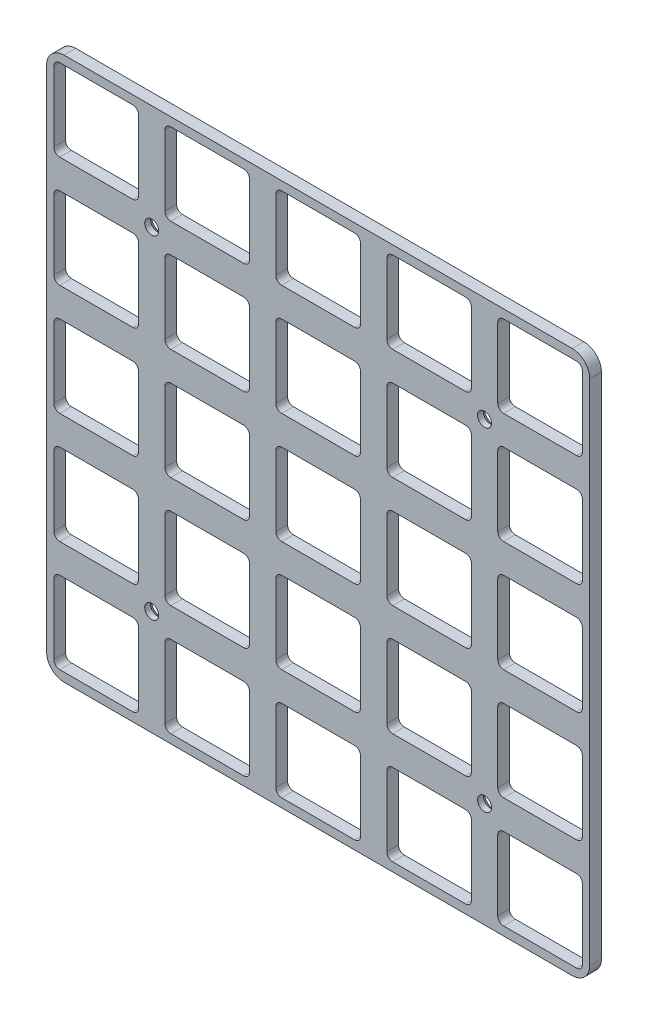
from build123d import *

# Parameters (mm, degrees)
BOSS_EXTRUDE1_DEPTH                            = 2
CSK_FOR_M2_FLAT_HEAD_MACHINE_SCREW1_AT_2_COUNT = 2
CSK_FOR_M2_FLAT_HEAD_MACHINE_SCREW1_AT_2_PITCH = 57
CSK_FOR_M2_FLAT_HEAD_MACHINE_SCREW1_AT_3_COUNT = 2
CSK_FOR_M2_FLAT_HEAD_MACHINE_SCREW1_AT_3_PITCH = 80.610173055
CSK_FOR_M2_FLAT_HEAD_MACHINE_SCREW1_AT_4_COUNT = 2
CSK_FOR_M2_FLAT_HEAD_MACHINE_SCREW1_AT_4_PITCH = 57


with BuildPart() as part:
    # Sketch2 → Boss-Extrude1 (new body)
    with BuildSketch(Plane.XY):
        with BuildLine():
            Line((-43.5, 46.5), (43.5, 46.5))
            ThreePointArc((43.5, 46.5), (45.621320344, 45.621320344), (46.5, 43.5))
            Line((46.5, 43.5), (46.5, -43.5))
            ThreePointArc((46.5, -43.5), (45.621320344, -45.621320344), (43.5, -46.5))
            Line((43.5, -46.5), (-43.5, -46.5))
            ThreePointArc((-43.5, -46.5), (-45.621320344, -45.621320344), (-46.5, -43.5))
            Line((-46.5, -43.5), (-46.5, 43.5))
            ThreePointArc((-46.5, 43.5), (-45.621320344, 45.621320344), (-43.5, 46.5))
        make_face()
        with BuildLine():
            Line((-26.25, 44), (-26.25, 32))
            ThreePointArc((-26.25, 32), (-25.957106781, 31.292893219), (-25.25, 31))
            Line((-25.25, 31), (-12.75, 31))
            ThreePointArc((-12.75, 31), (-12.042893219, 31.292893219), (-11.75, 32))
            Line((-11.75, 32), (-11.75, 44))
            ThreePointArc((-11.75, 44), (-12.042893219, 44.707106781), (-12.75, 45))
            Line((-12.75, 45), (-25.25, 45))
            ThreePointArc((-25.25, 45), (-25.957106781, 44.707106781), (-26.25, 44))
        make_face(mode=Mode.SUBTRACT)
        with BuildLine():
            Line((-44.25, 45), (-31.75, 45))
            ThreePointArc((-31.75, 45), (-31.042893219, 44.707106781), (-30.75, 44))
            Line((-30.75, 44), (-30.75, 32))
            ThreePointArc((-30.75, 32), (-31.042893219, 31.292893219), (-31.75, 31))
            Line((-31.75, 31), (-44.25, 31))
            ThreePointArc((-44.25, 31), (-44.957106781, 31.292893219), (-45.25, 32))
            Line((-45.25, 32), (-45.25, 44))
            ThreePointArc((-45.25, 44), (-44.957106781, 44.707106781), (-44.25, 45))
        make_face(mode=Mode.SUBTRACT)
        with BuildLine():
            Line((-7.25, 44), (-7.25, 32))
            ThreePointArc((-7.25, 32), (-6.957106781, 31.292893219), (-6.25, 31))
            Line((-6.25, 31), (6.25, 31))
            ThreePointArc((6.25, 31), (6.957106781, 31.292893219), (7.25, 32))
            Line((7.25, 32), (7.25, 44))
            ThreePointArc((7.25, 44), (6.957106781, 44.707106781), (6.25, 45))
            Line((6.25, 45), (-6.25, 45))
            ThreePointArc((-6.25, 45), (-6.957106781, 44.707106781), (-7.25, 44))
        make_face(mode=Mode.SUBTRACT)
        with BuildLine():
            Line((11.75, 44), (11.75, 32))
            ThreePointArc((11.75, 32), (12.042893219, 31.292893219), (12.75, 31))
            Line((12.75, 31), (25.25, 31))
            ThreePointArc((25.25, 31), (25.957106781, 31.292893219), (26.25, 32))
            Line((26.25, 32), (26.25, 44))
            ThreePointArc((26.25, 44), (25.957106781, 44.707106781), (25.25, 45))
            Line((25.25, 45), (12.75, 45))
            ThreePointArc((12.75, 45), (12.042893219, 44.707106781), (11.75, 44))
        make_face(mode=Mode.SUBTRACT)
        with BuildLine():
            Line((30.75, 44), (30.75, 32))
            ThreePointArc((30.75, 32), (31.042893219, 31.292893219), (31.75, 31))
            Line((31.75, 31), (44.25, 31))
            ThreePointArc((44.25, 31), (44.957106781, 31.292893219), (45.25, 32))
            Line((45.25, 32), (45.25, 44))
            ThreePointArc((45.25, 44), (44.957106781, 44.707106781), (44.25, 45))
            Line((44.25, 45), (31.75, 45))
            ThreePointArc((31.75, 45), (31.042893219, 44.707106781), (30.75, 44))
        make_face(mode=Mode.SUBTRACT)
        with BuildLine():
            Line((-26.25, 25), (-26.25, 13))
            ThreePointArc((-26.25, 13), (-25.957106781, 12.292893219), (-25.25, 12))
            Line((-25.25, 12), (-12.75, 12))
            ThreePointArc((-12.75, 12), (-12.042893219, 12.292893219), (-11.75, 13))
            Line((-11.75, 13), (-11.75, 25))
            ThreePointArc((-11.75, 25), (-12.042893219, 25.707106781), (-12.75, 26))
            Line((-12.75, 26), (-25.25, 26))
            ThreePointArc((-25.25, 26), (-25.957106781, 25.707106781), (-26.25, 25))
        make_face(mode=Mode.SUBTRACT)
        with BuildLine():
            Line((-7.25, 25), (-7.25, 13))
            ThreePointArc((-7.25, 13), (-6.957106781, 12.292893219), (-6.25, 12))
            Line((-6.25, 12), (6.25, 12))
            ThreePointArc((6.25, 12), (6.957106781, 12.292893219), (7.25, 13))
            Line((7.25, 13), (7.25, 25))
            ThreePointArc((7.25, 25), (6.957106781, 25.707106781), (6.25, 26))
            Line((6.25, 26), (-6.25, 26))
            ThreePointArc((-6.25, 26), (-6.957106781, 25.707106781), (-7.25, 25))
        make_face(mode=Mode.SUBTRACT)
        with BuildLine():
            Line((11.75, 25), (11.75, 13))
            ThreePointArc((11.75, 13), (12.042893219, 12.292893219), (12.75, 12))
            Line((12.75, 12), (25.25, 12))
            ThreePointArc((25.25, 12), (25.957106781, 12.292893219), (26.25, 13))
            Line((26.25, 13), (26.25, 25))
            ThreePointArc((26.25, 25), (25.957106781, 25.707106781), (25.25, 26))
            Line((25.25, 26), (12.75, 26))
            ThreePointArc((12.75, 26), (12.042893219, 25.707106781), (11.75, 25))
        make_face(mode=Mode.SUBTRACT)
        with BuildLine():
            Line((30.75, 25), (30.75, 13))
            ThreePointArc((30.75, 13), (31.042893219, 12.292893219), (31.75, 12))
            Line((31.75, 12), (44.25, 12))
            ThreePointArc((44.25, 12), (44.957106781, 12.292893219), (45.25, 13))
            Line((45.25, 13), (45.25, 25))
            ThreePointArc((45.25, 25), (44.957106781, 25.707106781), (44.25, 26))
            Line((44.25, 26), (31.75, 26))
            ThreePointArc((31.75, 26), (31.042893219, 25.707106781), (30.75, 25))
        make_face(mode=Mode.SUBTRACT)
        with BuildLine():
            Line((-26.25, 6), (-26.25, -6))
            ThreePointArc((-26.25, -6), (-25.957106781, -6.707106781), (-25.25, -7))
            Line((-25.25, -7), (-12.75, -7))
            ThreePointArc((-12.75, -7), (-12.042893219, -6.707106781), (-11.75, -6))
            Line((-11.75, -6), (-11.75, 6))
            ThreePointArc((-11.75, 6), (-12.042893219, 6.707106781), (-12.75, 7))
            Line((-12.75, 7), (-25.25, 7))
            ThreePointArc((-25.25, 7), (-25.957106781, 6.707106781), (-26.25, 6))
        make_face(mode=Mode.SUBTRACT)
        with BuildLine():
            Line((-7.25, 6), (-7.25, -6))
            ThreePointArc((-7.25, -6), (-6.957106781, -6.707106781), (-6.25, -7))
            Line((-6.25, -7), (6.25, -7))
            ThreePointArc((6.25, -7), (6.957106781, -6.707106781), (7.25, -6))
            Line((7.25, -6), (7.25, 6))
            ThreePointArc((7.25, 6), (6.957106781, 6.707106781), (6.25, 7))
            Line((6.25, 7), (-6.25, 7))
            ThreePointArc((-6.25, 7), (-6.957106781, 6.707106781), (-7.25, 6))
        make_face(mode=Mode.SUBTRACT)
        with BuildLine():
            Line((11.75, 6), (11.75, -6))
            ThreePointArc((11.75, -6), (12.042893219, -6.707106781), (12.75, -7))
            Line((12.75, -7), (25.25, -7))
            ThreePointArc((25.25, -7), (25.957106781, -6.707106781), (26.25, -6))
            Line((26.25, -6), (26.25, 6))
            ThreePointArc((26.25, 6), (25.957106781, 6.707106781), (25.25, 7))
            Line((25.25, 7), (12.75, 7))
            ThreePointArc((12.75, 7), (12.042893219, 6.707106781), (11.75, 6))
        make_face(mode=Mode.SUBTRACT)
        with BuildLine():
            Line((30.75, 6), (30.75, -6))
            ThreePointArc((30.75, -6), (31.042893219, -6.707106781), (31.75, -7))
            Line((31.75, -7), (44.25, -7))
            ThreePointArc((44.25, -7), (44.957106781, -6.707106781), (45.25, -6))
            Line((45.25, -6), (45.25, 6))
            ThreePointArc((45.25, 6), (44.957106781, 6.707106781), (44.25, 7))
            Line((44.25, 7), (31.75, 7))
            ThreePointArc((31.75, 7), (31.042893219, 6.707106781), (30.75, 6))
        make_face(mode=Mode.SUBTRACT)
        with BuildLine():
            Line((-26.25, -13), (-26.25, -25))
            ThreePointArc((-26.25, -25), (-25.957106781, -25.707106781), (-25.25, -26))
            Line((-25.25, -26), (-12.75, -26))
            ThreePointArc((-12.75, -26), (-12.042893219, -25.707106781), (-11.75, -25))
            Line((-11.75, -25), (-11.75, -13))
            ThreePointArc((-11.75, -13), (-12.042893219, -12.292893219), (-12.75, -12))
            Line((-12.75, -12), (-25.25, -12))
            ThreePointArc((-25.25, -12), (-25.957106781, -12.292893219), (-26.25, -13))
        make_face(mode=Mode.SUBTRACT)
        with BuildLine():
            Line((-7.25, -13), (-7.25, -25))
            ThreePointArc((-7.25, -25), (-6.957106781, -25.707106781), (-6.25, -26))
            Line((-6.25, -26), (6.25, -26))
            ThreePointArc((6.25, -26), (6.957106781, -25.707106781), (7.25, -25))
            Line((7.25, -25), (7.25, -13))
            ThreePointArc((7.25, -13), (6.957106781, -12.292893219), (6.25, -12))
            Line((6.25, -12), (-6.25, -12))
            ThreePointArc((-6.25, -12), (-6.957106781, -12.292893219), (-7.25, -13))
        make_face(mode=Mode.SUBTRACT)
        with BuildLine():
            Line((11.75, -13), (11.75, -25))
            ThreePointArc((11.75, -25), (12.042893219, -25.707106781), (12.75, -26))
            Line((12.75, -26), (25.25, -26))
            ThreePointArc((25.25, -26), (25.957106781, -25.707106781), (26.25, -25))
            Line((26.25, -25), (26.25, -13))
            ThreePointArc((26.25, -13), (25.957106781, -12.292893219), (25.25, -12))
            Line((25.25, -12), (12.75, -12))
            ThreePointArc((12.75, -12), (12.042893219, -12.292893219), (11.75, -13))
        make_face(mode=Mode.SUBTRACT)
        with BuildLine():
            Line((30.75, -13), (30.75, -25))
            ThreePointArc((30.75, -25), (31.042893219, -25.707106781), (31.75, -26))
            Line((31.75, -26), (44.25, -26))
            ThreePointArc((44.25, -26), (44.957106781, -25.707106781), (45.25, -25))
            Line((45.25, -25), (45.25, -13))
            ThreePointArc((45.25, -13), (44.957106781, -12.292893219), (44.25, -12))
            Line((44.25, -12), (31.75, -12))
            ThreePointArc((31.75, -12), (31.042893219, -12.292893219), (30.75, -13))
        make_face(mode=Mode.SUBTRACT)
        with BuildLine():
            Line((-26.25, -32), (-26.25, -44))
            ThreePointArc((-26.25, -44), (-25.957106781, -44.707106781), (-25.25, -45))
            Line((-25.25, -45), (-12.75, -45))
            ThreePointArc((-12.75, -45), (-12.042893219, -44.707106781), (-11.75, -44))
            Line((-11.75, -44), (-11.75, -32))
            ThreePointArc((-11.75, -32), (-12.042893219, -31.292893219), (-12.75, -31))
            Line((-12.75, -31), (-25.25, -31))
            ThreePointArc((-25.25, -31), (-25.957106781, -31.292893219), (-26.25, -32))
        make_face(mode=Mode.SUBTRACT)
        with BuildLine():
            Line((-7.25, -32), (-7.25, -44))
            ThreePointArc((-7.25, -44), (-6.957106781, -44.707106781), (-6.25, -45))
            Line((-6.25, -45), (6.25, -45))
            ThreePointArc((6.25, -45), (6.957106781, -44.707106781), (7.25, -44))
            Line((7.25, -44), (7.25, -32))
            ThreePointArc((7.25, -32), (6.957106781, -31.292893219), (6.25, -31))
            Line((6.25, -31), (-6.25, -31))
            ThreePointArc((-6.25, -31), (-6.957106781, -31.292893219), (-7.25, -32))
        make_face(mode=Mode.SUBTRACT)
        with BuildLine():
            Line((11.75, -32), (11.75, -44))
            ThreePointArc((11.75, -44), (12.042893219, -44.707106781), (12.75, -45))
            Line((12.75, -45), (25.25, -45))
            ThreePointArc((25.25, -45), (25.957106781, -44.707106781), (26.25, -44))
            Line((26.25, -44), (26.25, -32))
            ThreePointArc((26.25, -32), (25.957106781, -31.292893219), (25.25, -31))
            Line((25.25, -31), (12.75, -31))
            ThreePointArc((12.75, -31), (12.042893219, -31.292893219), (11.75, -32))
        make_face(mode=Mode.SUBTRACT)
        with BuildLine():
            Line((30.75, -32), (30.75, -44))
            ThreePointArc((30.75, -44), (31.042893219, -44.707106781), (31.75, -45))
            Line((31.75, -45), (44.25, -45))
            ThreePointArc((44.25, -45), (44.957106781, -44.707106781), (45.25, -44))
            Line((45.25, -44), (45.25, -32))
            ThreePointArc((45.25, -32), (44.957106781, -31.292893219), (44.25, -31))
            Line((44.25, -31), (31.75, -31))
            ThreePointArc((31.75, -31), (31.042893219, -31.292893219), (30.75, -32))
        make_face(mode=Mode.SUBTRACT)
        with BuildLine():
            Line((-45.25, 25), (-45.25, 13))
            ThreePointArc((-45.25, 13), (-44.957106781, 12.292893219), (-44.25, 12))
            Line((-44.25, 12), (-31.75, 12))
            ThreePointArc((-31.75, 12), (-31.042893219, 12.292893219), (-30.75, 13))
            Line((-30.75, 13), (-30.75, 25))
            ThreePointArc((-30.75, 25), (-31.042893219, 25.707106781), (-31.75, 26))
            Line((-31.75, 26), (-44.25, 26))
            ThreePointArc((-44.25, 26), (-44.957106781, 25.707106781), (-45.25, 25))
        make_face(mode=Mode.SUBTRACT)
        with BuildLine():
            Line((-45.25, 6), (-45.25, -6))
            ThreePointArc((-45.25, -6), (-44.957106781, -6.707106781), (-44.25, -7))
            Line((-44.25, -7), (-31.75, -7))
            ThreePointArc((-31.75, -7), (-31.042893219, -6.707106781), (-30.75, -6))
            Line((-30.75, -6), (-30.75, 6))
            ThreePointArc((-30.75, 6), (-31.042893219, 6.707106781), (-31.75, 7))
            Line((-31.75, 7), (-44.25, 7))
            ThreePointArc((-44.25, 7), (-44.957106781, 6.707106781), (-45.25, 6))
        make_face(mode=Mode.SUBTRACT)
        with BuildLine():
            Line((-45.25, -13), (-45.25, -25))
            ThreePointArc((-45.25, -25), (-44.957106781, -25.707106781), (-44.25, -26))
            Line((-44.25, -26), (-31.75, -26))
            ThreePointArc((-31.75, -26), (-31.042893219, -25.707106781), (-30.75, -25))
            Line((-30.75, -25), (-30.75, -13))
            ThreePointArc((-30.75, -13), (-31.042893219, -12.292893219), (-31.75, -12))
            Line((-31.75, -12), (-44.25, -12))
            ThreePointArc((-44.25, -12), (-44.957106781, -12.292893219), (-45.25, -13))
        make_face(mode=Mode.SUBTRACT)
        with BuildLine():
            Line((-45.25, -32), (-45.25, -44))
            ThreePointArc((-45.25, -44), (-44.957106781, -44.707106781), (-44.25, -45))
            Line((-44.25, -45), (-31.75, -45))
            ThreePointArc((-31.75, -45), (-31.042893219, -44.707106781), (-30.75, -44))
            Line((-30.75, -44), (-30.75, -32))
            ThreePointArc((-30.75, -32), (-31.042893219, -31.292893219), (-31.75, -31))
            Line((-31.75, -31), (-44.25, -31))
            ThreePointArc((-44.25, -31), (-44.957106781, -31.292893219), (-45.25, -32))
        make_face(mode=Mode.SUBTRACT)
    extrude(amount=BOSS_EXTRUDE1_DEPTH)

    # Sketch7 → CSK for M2 Flat Head Machine Screw1 (revolve, cut)
    with BuildSketch(Plane(origin=(-28.5, -28.5, 0), x_dir=(0, 1, 0), z_dir=(1, 0, 0))):
        Polygon((0, 0), (0, 2), (1.2, 2), (1.2, 1), (2.2, 0), align=None)
    csk_for_m2_flat_head_machine_screw1 = revolve(axis=Axis((-28.5, -28.5, -6.35), (0, 0, 1)), mode=Mode.SUBTRACT)

    # CSK for M2 Flat Head Machine Screw1 at 2: CSK for M2 Flat Head Machine Screw1 ×2
    with Locations(*[(i * CSK_FOR_M2_FLAT_HEAD_MACHINE_SCREW1_AT_2_PITCH, 0, 0) for i in range(1, CSK_FOR_M2_FLAT_HEAD_MACHINE_SCREW1_AT_2_COUNT)]):
        add(csk_for_m2_flat_head_machine_screw1, mode=Mode.SUBTRACT)

    # CSK for M2 Flat Head Machine Screw1 at 3: CSK for M2 Flat Head Machine Screw1 ×2
    with Locations(*[Vector(0.7071067811865474, 0.7071067811865477, 0) * (i * CSK_FOR_M2_FLAT_HEAD_MACHINE_SCREW1_AT_3_PITCH) for i in range(1, CSK_FOR_M2_FLAT_HEAD_MACHINE_SCREW1_AT_3_COUNT)]):
        add(csk_for_m2_flat_head_machine_screw1, mode=Mode.SUBTRACT)

    # CSK for M2 Flat Head Machine Screw1 at 4: CSK for M2 Flat Head Machine Screw1 ×2
    with Locations(*[(0, i * CSK_FOR_M2_FLAT_HEAD_MACHINE_SCREW1_AT_4_PITCH, 0) for i in range(1, CSK_FOR_M2_FLAT_HEAD_MACHINE_SCREW1_AT_4_COUNT)]):
        add(csk_for_m2_flat_head_machine_screw1, mode=Mode.SUBTRACT)


solid = part.part
